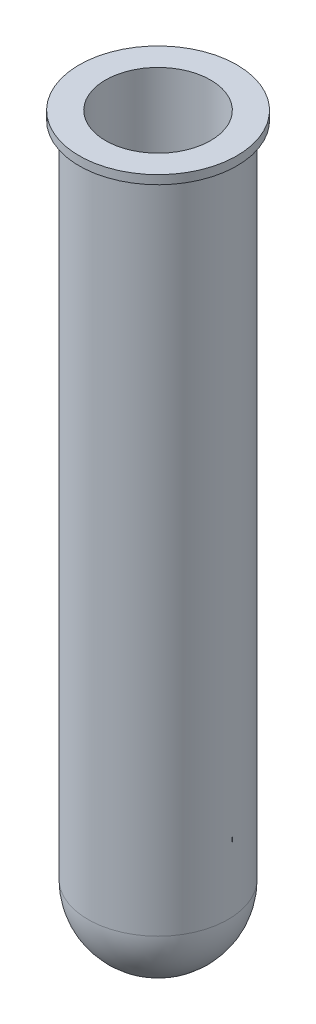
from build123d import *


with BuildPart() as part:
    # Sketch2 → Revolve1 (revolve)
    with BuildSketch(Plane.XY, mode=Mode.PRIVATE) as revolve1_sk:
        with BuildLine():
            Line((-6, 6), (-6, 81))
            Line((-6, 81), (-6, 82))
            Line((-6, 82), (-9, 82))
            Line((-9, 82), (-9, 81))
            Line((-9, 81), (-8, 81))
            Line((-8, 81), (-8, 6))
            ThreePointArc((-8, 6), (-5.656854249, 0.343145751), (0, -2))
            Line((0, -2), (0, 0))
            ThreePointArc((0, 0), (-4.242640687, 1.757359313), (-6, 6))
        make_face()
    revolve(revolve1_sk.sketch.rotate(Axis((0, 0, 0), (0, 1, 0)), 270), axis=Axis((0, 0, 0), (0, 1, 0)))


solid = part.part
